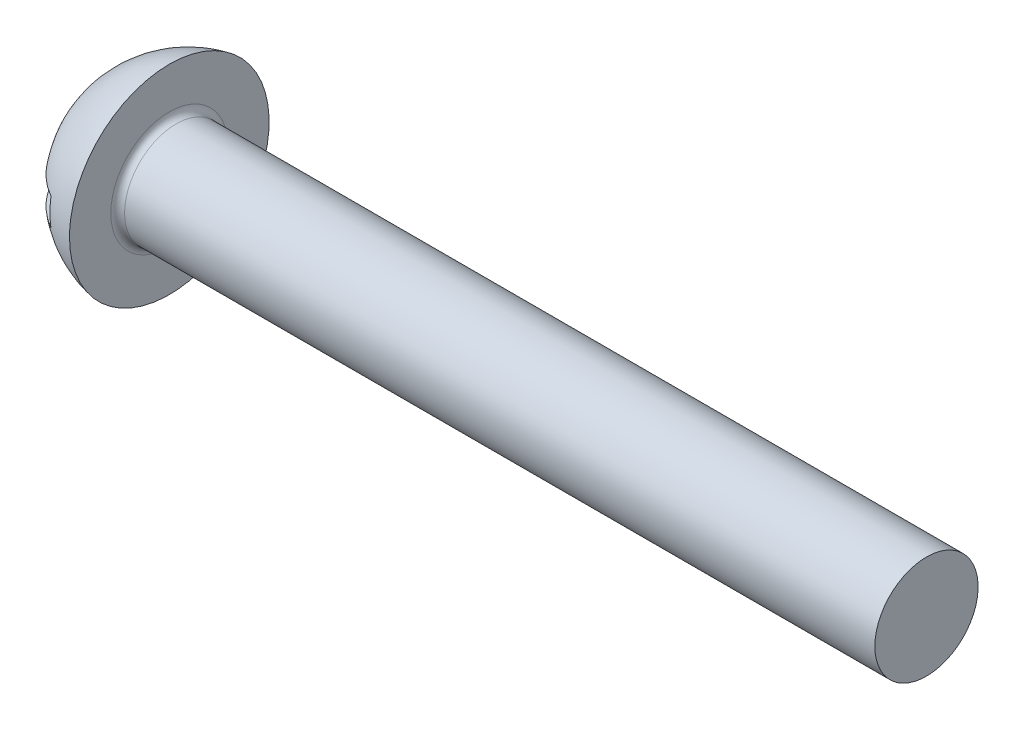
from build123d import *

# Parameters (mm, degrees)
SKETCH_2_W          = 5.8
SKETCH_2_H          = 0.8
CUT_EXTRUDE_1_DEPTH = 1.5
FILLET_1_R          = 0.2


with BuildPart() as part:
    # 草图1 → 旋转1 (revolve)
    with BuildSketch(Plane.XY):
        with BuildLine():
            Line((2.4, 2.9), (2.4, 1.5))
            Line((2.4, 1.5), (10.4, 1.5))
            Line((10.4, 1.5), (24.4, 1.5))
            Line((24.4, 1.5), (24.4, 0))
            Line((24.4, 0), (0, 0))
            ThreePointArc((0, 0), (0.677815098, 1.882153022), (2.4, 2.9))
        make_face()
    revolve(axis=Axis((0, 0, 0), (1, 0, 0)))

    # 草图2 → 切除-拉伸1 (cut)
    with BuildSketch(Plane(origin=(0, 0, 0), x_dir=(0, 0, -1), z_dir=(1, 0, 0))):
        Rectangle(SKETCH_2_W, SKETCH_2_H)
    extrude(amount=CUT_EXTRUDE_1_DEPTH, mode=Mode.SUBTRACT)

    # 圆角1
    fillet_1_edges = [part.edges().sort_by_distance(p)[0] for p in [
        (2.4, -1.5, 0),
    ]]
    fillet(fillet_1_edges, radius=FILLET_1_R)


solid = part.part
